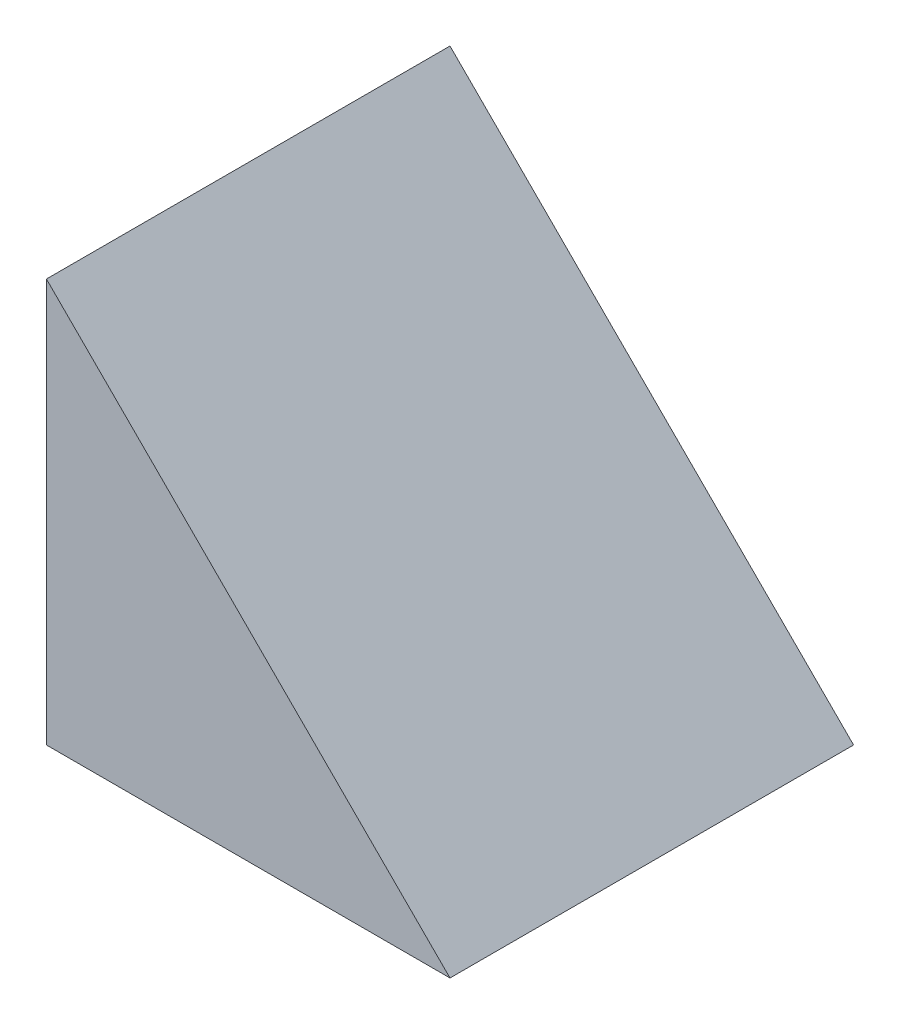
from build123d import *

# Parameters (mm, degrees)
BOSS_EXTRUDE1_DEPTH = 5000


with BuildPart() as part:
    # Sketch4 → Boss-Extrude1 (new body)
    with BuildSketch(Plane.XY):
        Polygon((-429.913122261, 4401.62342679), (4570.086877739, -598.37657321), (-429.913122261, -598.37657321), align=None)
    extrude(amount=BOSS_EXTRUDE1_DEPTH)


solid = part.part
